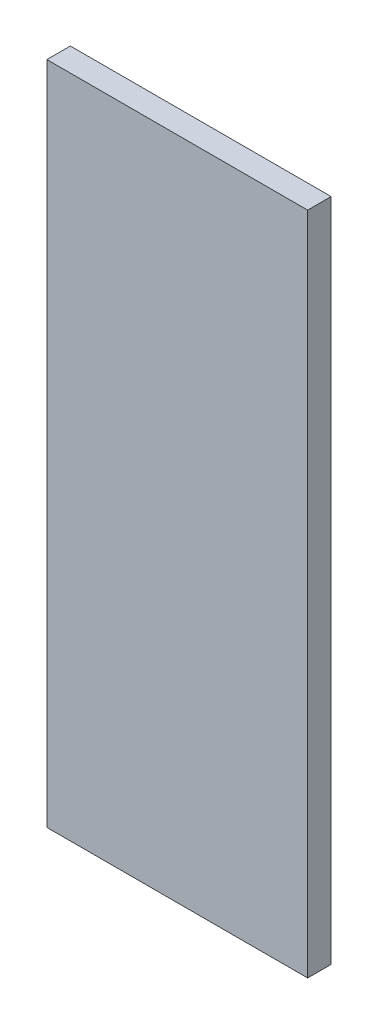
from build123d import *

# Parameters (mm, degrees)
SKETCH1_W           = 200
SKETCH1_H           = 510
BOSS_EXTRUDE1_DEPTH = 18


with BuildPart() as part:
    # Sketch1 → Boss-Extrude1 (new body)
    with BuildSketch(Plane.XY):
        Rectangle(SKETCH1_W, SKETCH1_H)
    extrude(amount=BOSS_EXTRUDE1_DEPTH)


solid = part.part
